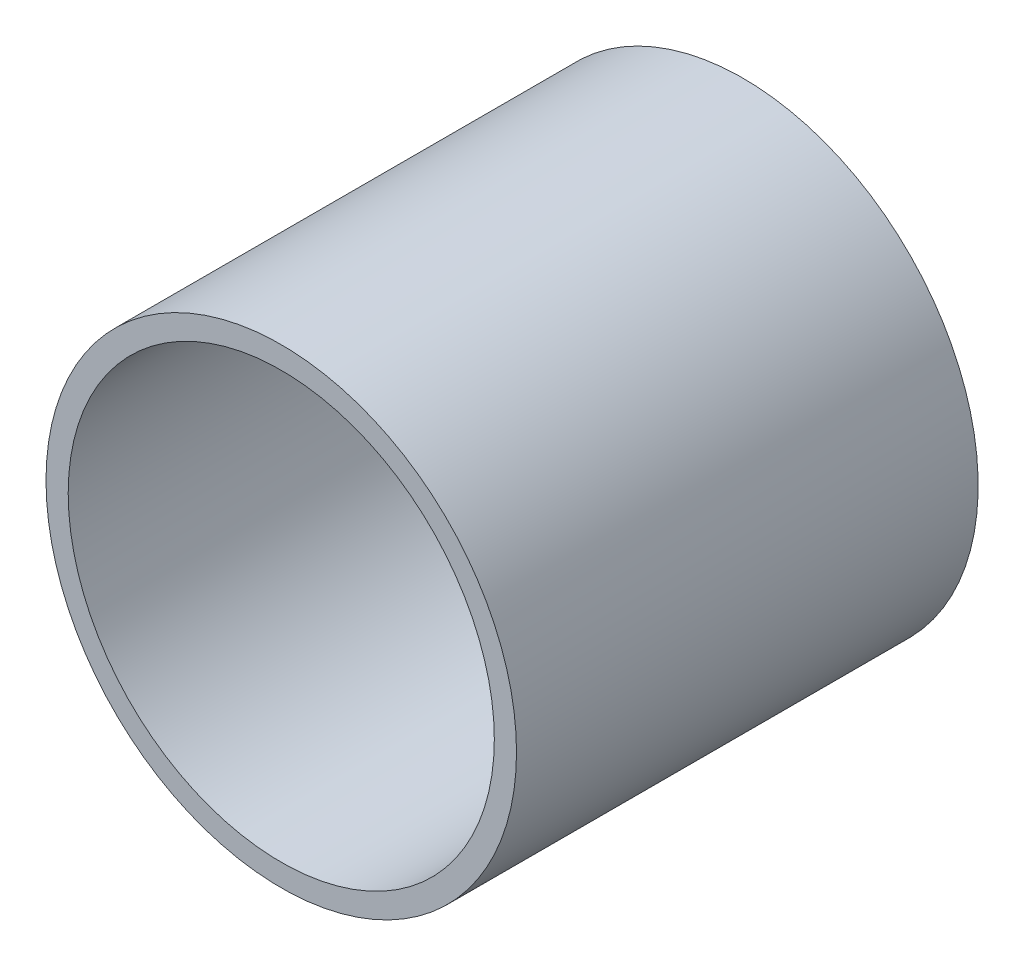
from build123d import *

# Parameters (mm, degrees)
SKETCH1_R           = 26.5
SKETCH1_R_2         = 24
BOSS_EXTRUDE1_DEPTH = 50
BOSS_EXTRUDE2_START = 2
SKETCH2_R           = 26.5
BOSS_EXTRUDE2_DEPTH = 2


with BuildPart() as part:
    # Sketch1 → Boss-Extrude1 (new body)
    with BuildSketch(Plane(origin=(0, 0, 0), x_dir=(0, 1, 0), z_dir=(0, 0, 1))):
        Circle(SKETCH1_R)
        Circle(SKETCH1_R_2, mode=Mode.SUBTRACT)
    extrude(amount=BOSS_EXTRUDE1_DEPTH)

    # Sketch2 → Boss-Extrude2 (add)
    with BuildSketch(Plane(origin=(0, 0, 0), x_dir=(1, 0, 0), z_dir=(0, 0, -1)).offset(BOSS_EXTRUDE2_START)):
        Circle(SKETCH2_R)
    extrude(amount=-BOSS_EXTRUDE2_DEPTH)

    # Sketch5 → Revolve1 (revolve)
    with BuildSketch(Plane.YZ):
        with BuildLine():
            Line((-26.5, 0), (-26.5, 4.8))
            Line((-26.5, 4.8), (-19.5, 4.8))
            add(Edge.make_bspline(
                [(-19.5, 4.8), (-19.143895577, 1.941095467), (-17, 0)],
                knots=[0, 0, 0, 1, 1, 1], degree=2))
            Line((-17, 0), (-26.5, 0))
        make_face()
    revolve(axis=Axis((0, 0, 0), (0, 0, 1)))


solid = part.part
